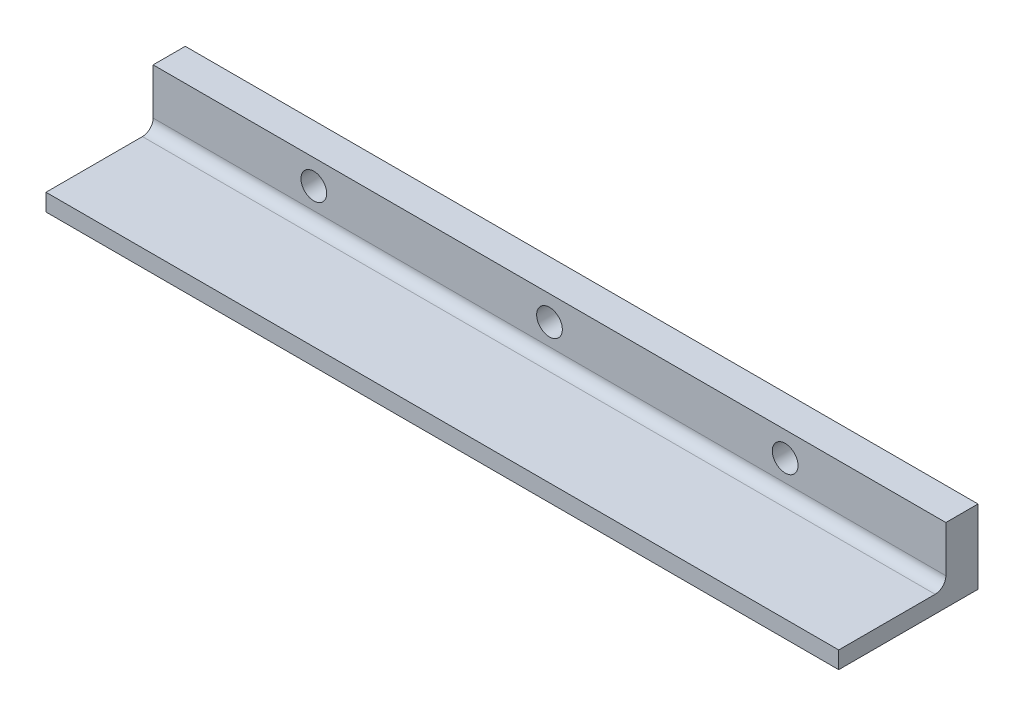
from build123d import *

# Parameters (mm, degrees)
SKETCH1_W            = 74
SKETCH1_H            = 13
BOSS_EXTRUDE1_DEPTH  = 1.6
SKETCH2_W            = 74
SKETCH2_H            = 3
BOSS_EXTRUDE2_DEPTH  = 5.3
FILLET1_R            = 1
M2_CLEARANCE_HOLE1_D = 2.4


with BuildPart() as part:
    # Sketch1 → Boss-Extrude1 (new body)
    with BuildSketch(Plane(origin=(0, 0, 0), x_dir=(1, 0, 0), z_dir=(0, 1, 0))):
        Rectangle(SKETCH1_W, SKETCH1_H)
    extrude(amount=BOSS_EXTRUDE1_DEPTH)

    # Sketch2 → Boss-Extrude2 (add)
    with BuildSketch(Plane(origin=(0, 1.6, 0), x_dir=(1, 0, 0), z_dir=(0, 1, 0))):
        with Locations((0, 5)):
            Rectangle(SKETCH2_W, SKETCH2_H)
    extrude(amount=BOSS_EXTRUDE2_DEPTH)

    # Fillet1
    fillet1_edges = [part.edges().sort_by_distance(p)[0] for p in [
        (0, 1.6, -3.5),
    ]]
    fillet(fillet1_edges, radius=FILLET1_R)

    # M2 Clearance Hole1 (through all)
    with Locations(Plane(origin=(-22, 4.6, -6.5), x_dir=(-1, 0, 0), z_dir=(0, 0, -1))):
        with Locations((0, 0), (-22, 0), (-44, 0)):
            Hole(M2_CLEARANCE_HOLE1_D / 2)


solid = part.part
